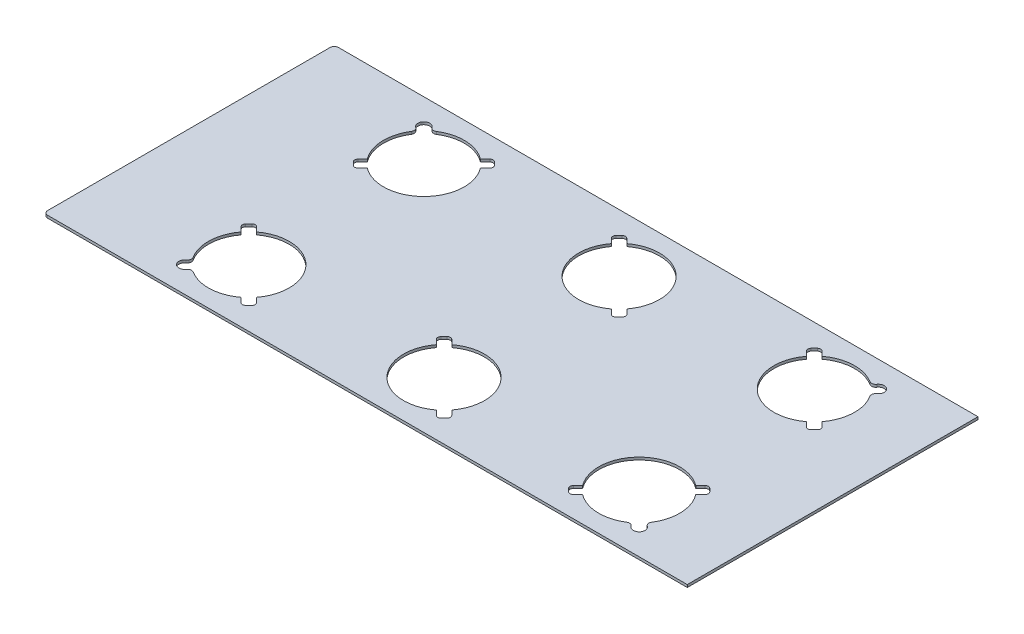
from build123d import *

# Parameters (mm, degrees)
SKETCH1_W                       = 368.3
SKETCH1_H                       = 177.8
BOSS_EXTRUDE1_DEPTH             = 1.5748
SKETCH2_W                       = 177.8
SKETCH2_H                       = 1.5748
BOSS_EXTRUDE2_DEPTH             = 25.4
CUT_EXTRUDE1_DEPTH              = 228.633241191
F_9_32_0_28125_DIAMETER_HOLE1_D = 7.14375
FILLET1_R                       = 2.54


with BuildPart() as part:
    # Sketch1 → Boss-Extrude1 (new body)
    with BuildSketch(Plane(origin=(0, 0, 0), x_dir=(1, 0, 0), z_dir=(0, 1, 0))):
        Rectangle(SKETCH1_W, SKETCH1_H)
    extrude(amount=BOSS_EXTRUDE1_DEPTH)

    # Sketch2 → Boss-Extrude2 (add)
    with BuildSketch(Plane.ZY.offset(184.15)):
        with Locations((0, 0.7874)):
            Rectangle(SKETCH2_W, SKETCH2_H)
    extrude(amount=BOSS_EXTRUDE2_DEPTH)

    # Sketch3 → Cut-Extrude1 (cut, through all)
    with BuildSketch(Plane.XZ):
        with BuildLine():
            Line((141.91869864, -35.729416794), (139.054032394, -38.59408304))
            ThreePointArc((139.054032394, -38.59408304), (136.846598155, -70.997098155), (104.44358304, -73.204532394))
            Line((104.44358304, -73.204532394), (101.578916794, -76.06919864))
            ThreePointArc((101.578916794, -76.06919864), (100.164703231, -76.654985078), (98.750489669, -76.06919864))
            Line((98.750489669, -76.06919864), (96.84130136, -74.160010331))
            ThreePointArc((96.84130136, -74.160010331), (96.255514922, -72.745796769), (96.84130136, -71.331583206))
            Line((96.84130136, -71.331583206), (99.705967606, -68.46691696))
            ThreePointArc((99.705967606, -68.46691696), (101.913401845, -36.063901845), (134.31641696, -33.856467606))
            Line((134.31641696, -33.856467606), (137.181083206, -30.99180136))
            ThreePointArc((137.181083206, -30.99180136), (138.595296769, -30.406014922), (140.009510331, -30.99180136))
            Line((140.009510331, -30.99180136), (141.91869864, -32.900989669))
            ThreePointArc((141.91869864, -32.900989669), (142.504485078, -34.315203231), (141.91869864, -35.729416794))
        make_face()
        with BuildLine():
            Line((22.53869864, -35.729416794), (19.674032394, -38.59408304))
            ThreePointArc((19.674032394, -38.59408304), (17.466598155, -70.997098155), (-14.93641696, -73.204532394))
            Line((-14.93641696, -73.204532394), (-17.801083206, -76.06919864))
            ThreePointArc((-17.801083206, -76.06919864), (-19.215296769, -76.654985078), (-20.629510331, -76.06919864))
            Line((-20.629510331, -76.06919864), (-22.53869864, -74.160010331))
            ThreePointArc((-22.53869864, -74.160010331), (-23.124485078, -72.745796769), (-22.53869864, -71.331583206))
            Line((-22.53869864, -71.331583206), (-19.674032394, -68.46691696))
            ThreePointArc((-19.674032394, -68.46691696), (-17.466598155, -36.063901845), (14.93641696, -33.856467606))
            Line((14.93641696, -33.856467606), (17.801083206, -30.99180136))
            ThreePointArc((17.801083206, -30.99180136), (19.215296769, -30.406014922), (20.629510331, -30.99180136))
            Line((20.629510331, -30.99180136), (22.53869864, -32.900989669))
            ThreePointArc((22.53869864, -32.900989669), (23.124485078, -34.315203231), (22.53869864, -35.729416794))
        make_face()
        with BuildLine():
            Line((-137.181083206, -30.99180136), (-134.31641696, -33.856467606))
            ThreePointArc((-134.31641696, -33.856467606), (-101.913401845, -36.063901845), (-99.705967606, -68.46691696))
            Line((-99.705967606, -68.46691696), (-96.84130136, -71.331583206))
            ThreePointArc((-96.84130136, -71.331583206), (-96.255514922, -72.745796769), (-96.84130136, -74.160010331))
            Line((-96.84130136, -74.160010331), (-98.750489669, -76.06919864))
            ThreePointArc((-98.750489669, -76.06919864), (-100.164703231, -76.654985078), (-101.578916794, -76.06919864))
            Line((-101.578916794, -76.06919864), (-104.44358304, -73.204532394))
            ThreePointArc((-104.44358304, -73.204532394), (-136.846598155, -70.997098155), (-139.054032394, -38.59408304))
            Line((-139.054032394, -38.59408304), (-141.91869864, -35.729416794))
            ThreePointArc((-141.91869864, -35.729416794), (-142.504485078, -34.315203231), (-141.91869864, -32.900989669))
            Line((-141.91869864, -32.900989669), (-140.009510331, -30.99180136))
            ThreePointArc((-140.009510331, -30.99180136), (-138.595296769, -30.406014922), (-137.181083206, -30.99180136))
        make_face()
        with BuildLine():
            Line((-134.31641696, 33.856467606), (-137.181083206, 30.99180136))
            ThreePointArc((-137.181083206, 30.99180136), (-138.595296769, 30.406014922), (-140.009510331, 30.99180136))
            Line((-140.009510331, 30.99180136), (-141.91869864, 32.900989669))
            ThreePointArc((-141.91869864, 32.900989669), (-142.504485078, 34.315203231), (-141.91869864, 35.729416794))
            Line((-141.91869864, 35.729416794), (-139.054032394, 38.59408304))
            ThreePointArc((-139.054032394, 38.59408304), (-136.846598155, 70.997098155), (-104.44358304, 73.204532394))
            Line((-104.44358304, 73.204532394), (-101.578916794, 76.06919864))
            ThreePointArc((-101.578916794, 76.06919864), (-100.164703231, 76.654985078), (-98.750489669, 76.06919864))
            Line((-98.750489669, 76.06919864), (-96.84130136, 74.160010331))
            ThreePointArc((-96.84130136, 74.160010331), (-96.255514922, 72.745796769), (-96.84130136, 71.331583206))
            Line((-96.84130136, 71.331583206), (-99.705967606, 68.46691696))
            ThreePointArc((-99.705967606, 68.46691696), (-101.913401845, 36.063901845), (-134.31641696, 33.856467606))
        make_face()
        with BuildLine():
            Line((14.93641696, 73.204532394), (17.801083206, 76.06919864))
            ThreePointArc((17.801083206, 76.06919864), (19.215296769, 76.654985078), (20.629510331, 76.06919864))
            Line((20.629510331, 76.06919864), (22.53869864, 74.160010331))
            ThreePointArc((22.53869864, 74.160010331), (23.124485078, 72.745796769), (22.53869864, 71.331583206))
            Line((22.53869864, 71.331583206), (19.674032394, 68.46691696))
            ThreePointArc((19.674032394, 68.46691696), (17.466598155, 36.063901845), (-14.93641696, 33.856467606))
            Line((-14.93641696, 33.856467606), (-17.801083206, 30.99180136))
            ThreePointArc((-17.801083206, 30.99180136), (-19.215296769, 30.406014922), (-20.629510331, 30.99180136))
            Line((-20.629510331, 30.99180136), (-22.53869864, 32.900989669))
            ThreePointArc((-22.53869864, 32.900989669), (-23.124485078, 34.315203231), (-22.53869864, 35.729416794))
            Line((-22.53869864, 35.729416794), (-19.674032394, 38.59408304))
            ThreePointArc((-19.674032394, 38.59408304), (-17.466598155, 70.997098155), (14.93641696, 73.204532394))
        make_face()
        with BuildLine():
            Line((101.578916794, 76.06919864), (104.44358304, 73.204532394))
            ThreePointArc((104.44358304, 73.204532394), (136.846598155, 70.997098155), (139.054032394, 38.59408304))
            Line((139.054032394, 38.59408304), (141.91869864, 35.729416794))
            ThreePointArc((141.91869864, 35.729416794), (142.504485078, 34.315203231), (141.91869864, 32.900989669))
            Line((141.91869864, 32.900989669), (140.009510331, 30.99180136))
            ThreePointArc((140.009510331, 30.99180136), (138.595296769, 30.406014922), (137.181083206, 30.99180136))
            Line((137.181083206, 30.99180136), (134.31641696, 33.856467606))
            ThreePointArc((134.31641696, 33.856467606), (101.913401845, 36.063901845), (99.705967606, 68.46691696))
            Line((99.705967606, 68.46691696), (96.84130136, 71.331583206))
            ThreePointArc((96.84130136, 71.331583206), (96.255514922, 72.745796769), (96.84130136, 74.160010331))
            Line((96.84130136, 74.160010331), (98.750489669, 76.06919864))
            ThreePointArc((98.750489669, 76.06919864), (100.164703231, 76.654985078), (101.578916794, 76.06919864))
        make_face()
    extrude(amount=-CUT_EXTRUDE1_DEPTH, mode=Mode.SUBTRACT)

    # 9/32 (0.28125) Diameter Hole1 (through all)
    with Locations(Plane(origin=(0, 0, 0), x_dir=(-1, 0, 0), z_dir=(0, -1, 0))):
        with Locations((-139.0015, 73.152), (139.0015, 73.152), (139.0015, -73.152), (-139.0015, -73.152)):
            Hole(F_9_32_0_28125_DIAMETER_HOLE1_D / 2)

    # Fillet1
    fillet1_edges = [part.edges().sort_by_distance(p)[0] for p in [
        (-209.55, 0.7874, 88.9),
        (-209.55, 0.7874, -88.9),
        (138.04454174, 0.7874, 69.710703456),
        (135.560203456, 0.7874, 72.19504174),
        (-135.560203456, 0.7874, 72.19504174),
        (-138.04454174, 0.7874, 69.710703456),
        (-138.04454174, 0.7874, -69.710703456),
        (-135.560203456, 0.7874, -72.19504174),
        (135.560203456, 0.7874, -72.19504174),
        (138.04454174, 0.7874, -69.710703456),
    ]]
    fillet(fillet1_edges, radius=FILLET1_R)


solid = part.part
